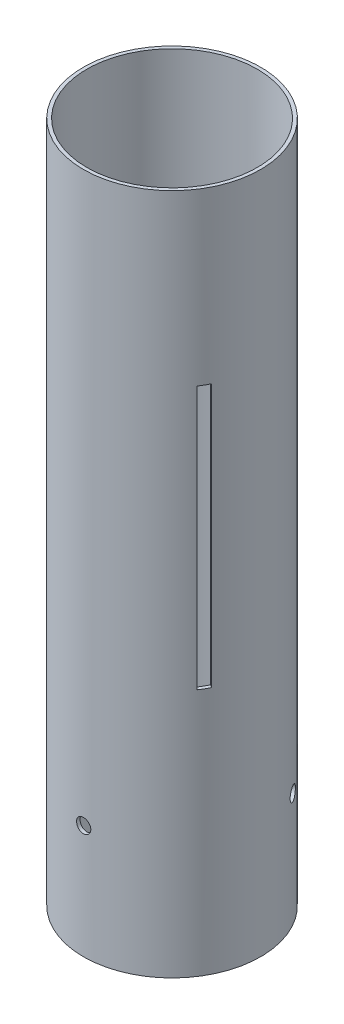
from build123d import *

# Parameters (mm, degrees)
SKETCH2_R           = 39.624
SKETCH2_R_2         = 38.1
BOSS_EXTRUDE1_DEPTH = 304.8
SKETCH3_W           = 4.7625
SKETCH3_H           = 117.602
CUT_EXTRUDE1_DEPTH  = 310.908313461
CIRPATTERN1_COUNT   = 3
SKETCH4_R           = 3.175
CUT_EXTRUDE3_DEPTH  = 310.908313461
CIRPATTERN2_COUNT   = 3


with BuildPart() as part:
    # Sketch2 → Boss-Extrude1 (new body)
    with BuildSketch(Plane(origin=(0, 0, 0), x_dir=(1, 0, 0), z_dir=(0, 1, 0))):
        with Locations(Location((0, 0, 0), (0, 0, 90))):
            Circle(SKETCH2_R)
        with Locations(Location((0, 0, 0), (0, 0, 90))):
            Circle(SKETCH2_R_2, mode=Mode.SUBTRACT)
    extrude(amount=BOSS_EXTRUDE1_DEPTH)

    # Sketch3 → Cut-Extrude1 (cut, through all)
    with BuildSketch(Plane.XY):
        with Locations((0, 169.799)):
            Rectangle(SKETCH3_W, SKETCH3_H)
    cut_extrude1 = extrude(amount=-CUT_EXTRUDE1_DEPTH, mode=Mode.SUBTRACT)

    # CirPattern1: Cut-Extrude1 ×3 about axis
    cirpattern1_axis = Axis((0, 0, 0), (0, 1, 0))
    for i in range(1, CIRPATTERN1_COUNT):
        add(cut_extrude1.rotate(cirpattern1_axis, i * 360 / CIRPATTERN1_COUNT), mode=Mode.SUBTRACT)

    # Sketch4 → Cut-Extrude3 (cut, through all)
    with BuildSketch(Plane.XY):
        with Locations(Location((0, 50.8, 0), (0, 0, 270.000000034))):
            Circle(SKETCH4_R)
    cut_extrude3 = extrude(amount=CUT_EXTRUDE3_DEPTH, mode=Mode.SUBTRACT)

    # CirPattern2: Cut-Extrude3 ×3 about axis
    cirpattern2_axis = Axis((0, 304.8, 0), (0, -1, 0))
    for i in range(1, CIRPATTERN2_COUNT):
        add(cut_extrude3.rotate(cirpattern2_axis, i * 360 / CIRPATTERN2_COUNT), mode=Mode.SUBTRACT)


solid = part.part
